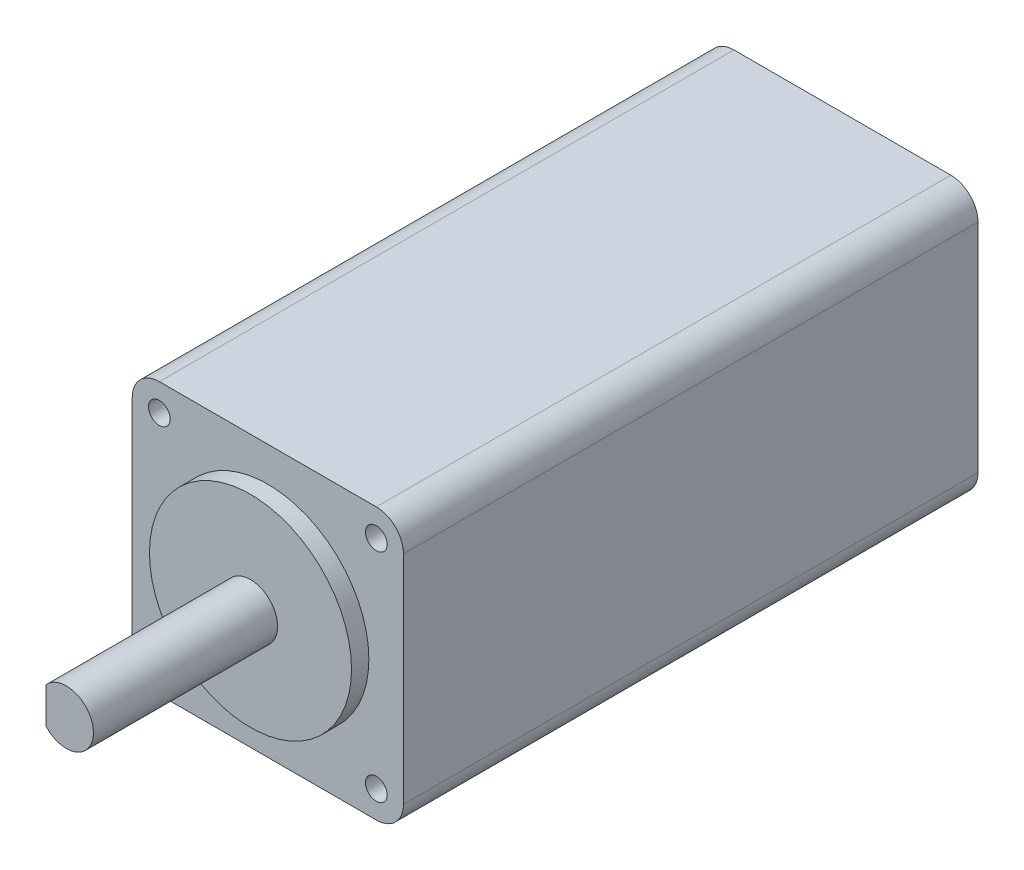
from build123d import *

# Parameters (mm, degrees)
BOSS_EXTRUDE1_DEPTH   = 42.37
SKETCH2_R             = 7.45
BOSS_EXTRUDE2_DEPTH   = 1.28
BOSS_EXTRUDE3_DEPTH   = 13.58
SKETCH4_W             = 4.9
SKETCH4_H             = 11.6
BOSS_EXTRUDE4_DEPTH   = 3
M2_TAPPED_HOLE1_D     = 1.6
M2_TAPPED_HOLE1_DEPTH = 4
M2_TAPPED_HOLE1_TIP   = 0.480688495


with BuildPart() as part:
    # Sketch1 → Boss-Extrude1 (new body)
    with BuildSketch(Plane.XY):
        with BuildLine():
            Line((-8, -10), (8, -10))
            ThreePointArc((8, -10), (9.414213562, -9.414213562), (10, -8))
            Line((10, -8), (10, 8))
            ThreePointArc((10, 8), (9.414213562, 9.414213562), (8, 10))
            Line((8, 10), (-8, 10))
            ThreePointArc((-8, 10), (-9.414213562, 9.414213562), (-10, 8))
            Line((-10, 8), (-10, -8))
            ThreePointArc((-10, -8), (-9.414213562, -9.414213562), (-8, -10))
        make_face()
    extrude(amount=BOSS_EXTRUDE1_DEPTH)

    # Sketch2 → Boss-Extrude2 (add)
    with BuildSketch(Plane.XY.offset(42.37)):
        with Locations(Location((0, 0, 0), (0, 0, 180))):
            Circle(SKETCH2_R)
    extrude(amount=BOSS_EXTRUDE2_DEPTH)

    # Sketch3 → Boss-Extrude3 (add)
    with BuildSketch(Plane.XY.offset(43.65)):
        with BuildLine():
            Line((-1.5, 1.322875656), (-1.5, -1.322875656))
            ThreePointArc((-1.5, -1.322875656), (2, 0), (-1.5, 1.322875656))
        make_face()
    extrude(amount=BOSS_EXTRUDE3_DEPTH)

    # Sketch4 → Boss-Extrude4 (add)
    with BuildSketch(Plane.ZY.offset(10)):
        with Locations((5.45, 0)):
            Rectangle(SKETCH4_W, SKETCH4_H)
    extrude(amount=BOSS_EXTRUDE4_DEPTH)

    # M2 Tapped Hole1
    with Locations(Plane.XY.offset(42.37)):
        with Locations((-8, -8), (8, -8), (8, 8), (-8, 8)):
            Hole(M2_TAPPED_HOLE1_D / 2, depth=M2_TAPPED_HOLE1_DEPTH)
            with Locations((0, 0, -(M2_TAPPED_HOLE1_DEPTH + M2_TAPPED_HOLE1_TIP / 2))):  # 118° drill point
                Cone(0, M2_TAPPED_HOLE1_D / 2, M2_TAPPED_HOLE1_TIP, mode=Mode.SUBTRACT)


solid = part.part
